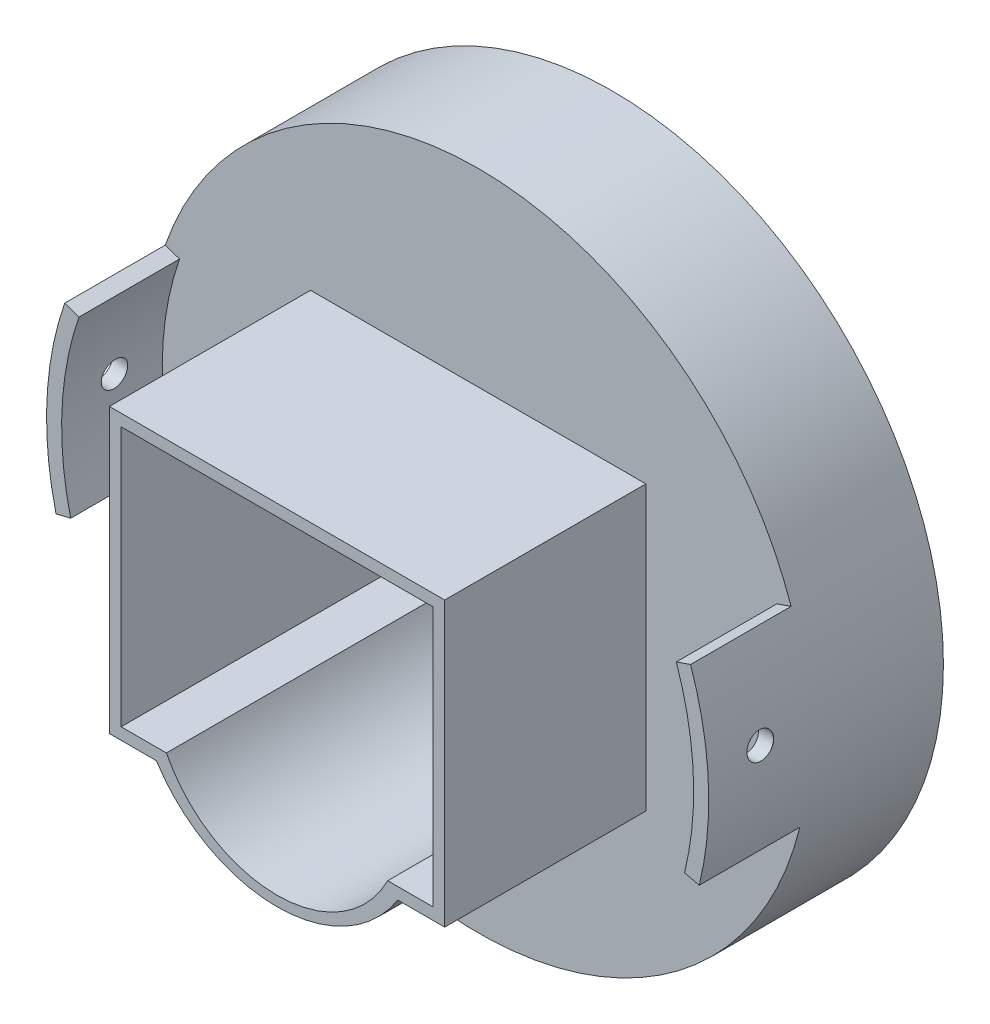
from build123d import *
from build123d.topology import SkipClean

# Parameters (mm, degrees)
SKETCH1_R           = 50.165
BOSS_EXTRUDE1_DEPTH = 20.32
SKETCH4_W           = 6.858
SKETCH4_H           = 39.37
BOSS_EXTRUDE3_DEPTH = 7.62
BOSS_EXTRUDE4_DEPTH = 30.48
BOSS_EXTRUDE5_DEPTH = 15.24


with BuildPart() as part:
    # Sketch1 → Boss-Extrude1 (new body)
    with BuildSketch(Plane.XY):
        Circle(SKETCH1_R)
        with BuildLine():
            Line((16.764, -19.685), (23.622, -19.685))
            Line((23.622, -19.685), (23.622, 19.685))
            Line((23.622, 19.685), (-23.622, 19.685))
            Line((-23.622, 19.685), (-23.622, -19.685))
            Line((-23.622, -19.685), (-16.764, -19.685))
            ThreePointArc((-16.764, -19.685), (0, -29.98053413), (16.764, -19.685))
        make_face(mode=Mode.SUBTRACT)
    extrude(amount=BOSS_EXTRUDE1_DEPTH)

    # Sketch4 → Boss-Extrude3 (add)
    with BuildSketch(Plane(origin=(0, 0, 0), x_dir=(-1, 0, 0), z_dir=(0, 0, -1))):
        with Locations((-20.193, 0)):
            Rectangle(SKETCH4_W, SKETCH4_H)
        with Locations((20.193, 0)):
            Rectangle(SKETCH4_W, SKETCH4_H)
    extrude(amount=-BOSS_EXTRUDE3_DEPTH)

    # Sketch5 → Boss-Extrude4 (add)
    with BuildSketch(Plane.XY.offset(20.32)):
        with BuildLine():
            ThreePointArc((-18.288, -21.463), (0, -31.496), (18.288, -21.463))
            Line((18.288, -21.463), (25.4, -21.463))
            Line((25.4, -21.463), (25.4, 21.463))
            Line((25.4, 21.463), (-25.4, 21.463))
            Line((-25.4, 21.463), (-25.4, -21.463))
            Line((-25.4, -21.463), (-18.288, -21.463))
        make_face()
        with BuildLine():
            Line((-16.764, -19.685), (-23.622, -19.685))
            Line((-23.622, -19.685), (-23.622, 19.685))
            Line((-23.622, 19.685), (23.622, 19.685))
            Line((23.622, 19.685), (23.622, -19.685))
            Line((23.622, -19.685), (16.764, -19.685))
            ThreePointArc((16.764, -19.685), (0, -29.98053413), (-16.764, -19.685))
        make_face(mode=Mode.SUBTRACT)
    extrude(amount=BOSS_EXTRUDE4_DEPTH)

    # Sketch6 → Boss-Extrude5 (add)
    with BuildSketch(Plane.XY.offset(20.32)):
        with BuildLine():
            Line((47.411991955, 16.389943375), (45.251445486, 15.64305988))
            ThreePointArc((45.251445486, 15.64305988), (47.827461768, 2.220932657), (46.506398035, -11.382160729))
            Line((46.506398035, -11.382160729), (48.726862662, -11.925606068))
            ThreePointArc((48.726862662, -11.925606068), (50.111001056, 2.326971882), (47.411991955, 16.389943375))
        make_face()
    boss_extrude5 = extrude(amount=BOSS_EXTRUDE5_DEPTH)

    # Sketch8 → Ø4.0mm Dowel Hole1 (revolve, cut)
    with BuildSketch(Plane(origin=(50.068129829, 3.116023177, 27.647369776), x_dir=(-0.062115482456496916, 0.9980689689791966, 0), z_dir=(0, 0, 1))):
        Polygon((0, 0), (0, 5.011721238), (2, 3.81), (2, 0.020977491), (2.025, 0), align=None)
    f_4_0mm_dowel_hole1 = revolve(axis=Axis((56.405867782, 3.510456491, 27.647369776), (-0.9980689689791966, -0.06211548245649691, 0)), mode=Mode.SUBTRACT)

    # Mirror1: Boss-Extrude5, Ø4.0mm Dowel Hole1 across plane
    with SkipClean():  # the faces are left unmerged after this step: merging them gives an invalid solid
        add(boss_extrude5.mirror(Plane(origin=(0, 0, 0), x_dir=(0, 0, 1), z_dir=(1, 0, 0))))
        add(f_4_0mm_dowel_hole1.mirror(Plane(origin=(0, 0, 0), x_dir=(0, 0, 1), z_dir=(1, 0, 0))), mode=Mode.SUBTRACT)


solid = part.part
